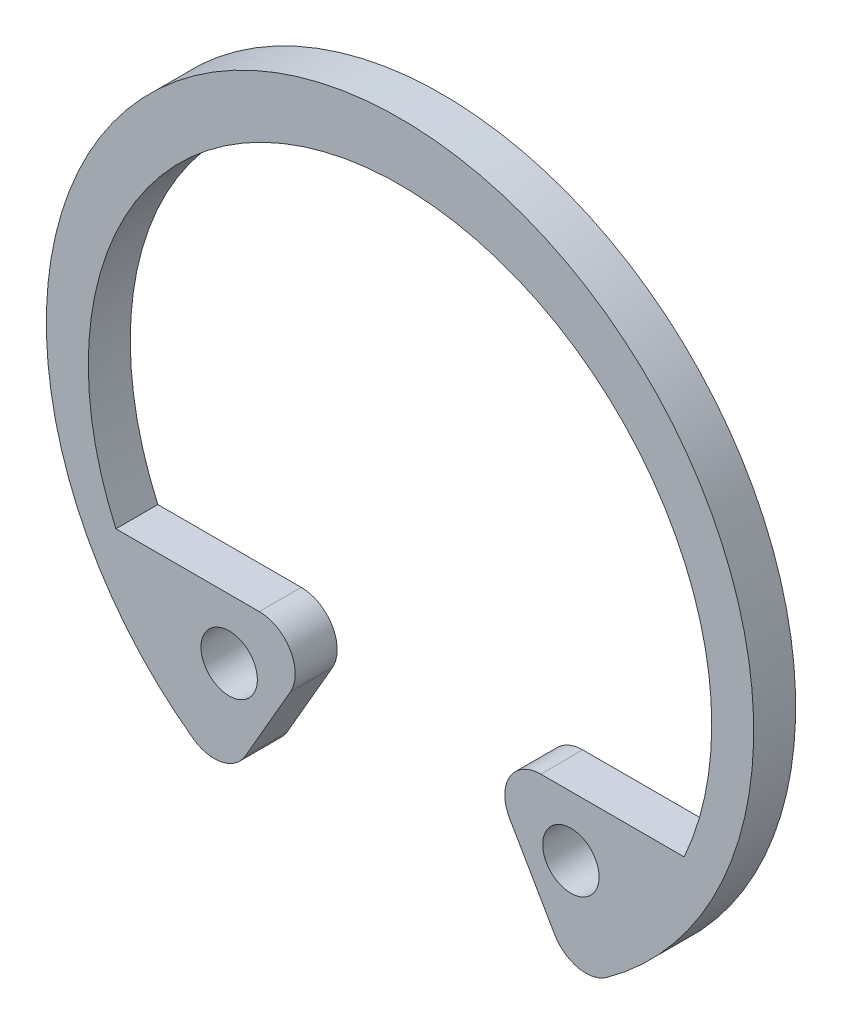
from build123d import *

# Parameters (mm, degrees)
BASE_SKETCH_R = 0.5969
BASE_DEPTH    = 0.889


with BuildPart() as part:
    # Base Sketch → Base (new body)
    with BuildSketch(Plane.XY):
        with BuildLine():
            Line((-2.321834428, -4.191), (-3.275039722, -5.842))
            ThreePointArc((-3.275039722, -5.842), (-3.775058057, -6.206035718), (-4.38041724, -6.079226415))
            ThreePointArc((-4.38041724, -6.079226415), (0, 7.493), (4.38041724, -6.079226415))
            ThreePointArc((4.38041724, -6.079226415), (3.775058057, -6.206035718), (3.275039722, -5.842))
            Line((3.275039722, -5.842), (2.321834428, -4.191))
            ThreePointArc((2.321834428, -4.191), (2.321834428, -3.429), (2.981745785, -3.048))
            Line((2.981745785, -3.048), (6.018835366, -3.048))
            ThreePointArc((6.018835366, -3.048), (0, 6.2738), (-6.018835366, -3.048))
            Line((-6.018835366, -3.048), (-2.981745785, -3.048))
            ThreePointArc((-2.981745785, -3.048), (-2.321834428, -3.429), (-2.321834428, -4.191))
        make_face()
        with Locations((3.6195, -4.318)):
            Circle(BASE_SKETCH_R, mode=Mode.SUBTRACT)
        with Locations(Location((-3.6195, -4.318, 0), (0, 0, 180))):
            Circle(BASE_SKETCH_R, mode=Mode.SUBTRACT)
    extrude(amount=-BASE_DEPTH)


solid = part.part
